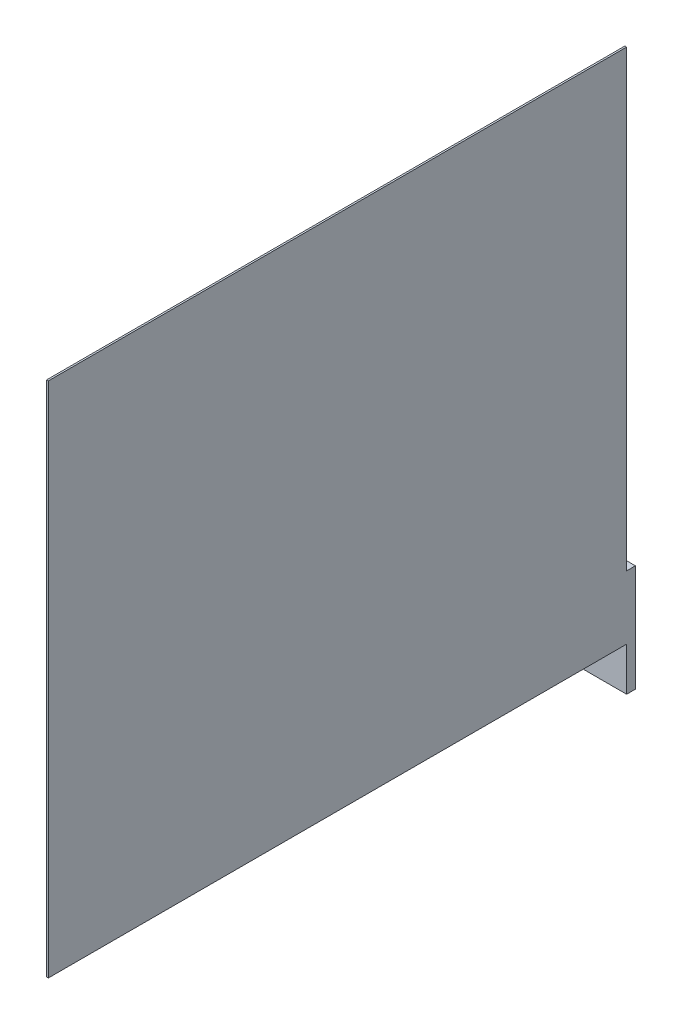
from build123d import *

# Parameters (mm, degrees)
SKETCH_1_W      = 24.373693789
SKETCH_1_H      = 24.4
EXTRUDE_1_DEPTH = 2
SKETCH_2_W      = 0.399318558
SKETCH_2_H      = 118.043550316
EXTRUDE_2_DEPTH = 132
FILLET_1_R      = 10


with BuildPart() as part:
    # 草图1 → 凸台-拉伸1 (new body)
    with BuildSketch(Plane.XY):
        with Locations((-100.454369689, -61.448491789)):
            Rectangle(SKETCH_1_W, SKETCH_1_H)
    extrude(amount=EXTRUDE_1_DEPTH)

    # 草图2 → 凸台-拉伸2 (add)
    with BuildSketch(Plane.XY.offset(2)):
        with Locations((-88.467182073, -4.716082398)):
            Rectangle(SKETCH_2_W, SKETCH_2_H)
    extrude(amount=EXTRUDE_2_DEPTH)

    # 圆角1
    fillet_1_edges = [part.edges().sort_by_distance(p)[0] for p in [
        (-88.666841352, -56.493174673, 2),
    ]]
    fillet(fillet_1_edges, radius=FILLET_1_R)


solid = part.part
